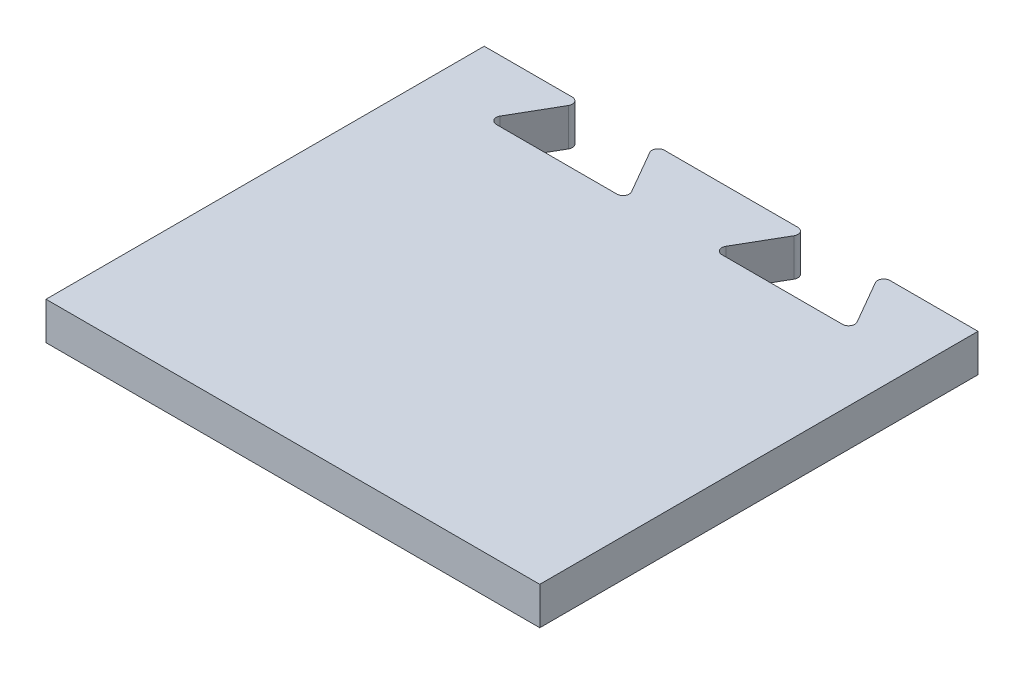
from build123d import *

# Parameters (mm, degrees)
BOSS_EXTRUDE1_DEPTH = 3.05
FILLET3_R           = 0.5


with BuildPart() as part:
    # Sketch1 → Boss-Extrude1 (new body)
    with BuildSketch(Plane(origin=(0, 0, 0), x_dir=(1, 0, 0), z_dir=(0, 1, 0))):
        Polygon((0, 0), (0, 35.5), (8, 35.5), (5.113248654, 30.5), (16.613248654, 30.5), (13.726497308, 35.5), (26.273502692, 35.5), (23.386751346, 30.5), (34.886751346, 30.5), (32, 35.5), (40, 35.5), (40, 0), align=None)
    extrude(amount=BOSS_EXTRUDE1_DEPTH)

    # Fillet3
    fillet3_edges = [part.edges().sort_by_distance(p)[0] for p in [
        (8, 1.525, -35.5),
        (5.113248654, 1.525, -30.5),
        (16.613248654, 1.525, -30.5),
        (13.726497308, 1.525, -35.5),
        (26.273502692, 1.525, -35.5),
        (23.386751346, 1.525, -30.5),
        (34.886751346, 1.525, -30.5),
        (32, 1.525, -35.5),
    ]]
    fillet(fillet3_edges, radius=FILLET3_R)


solid = part.part
